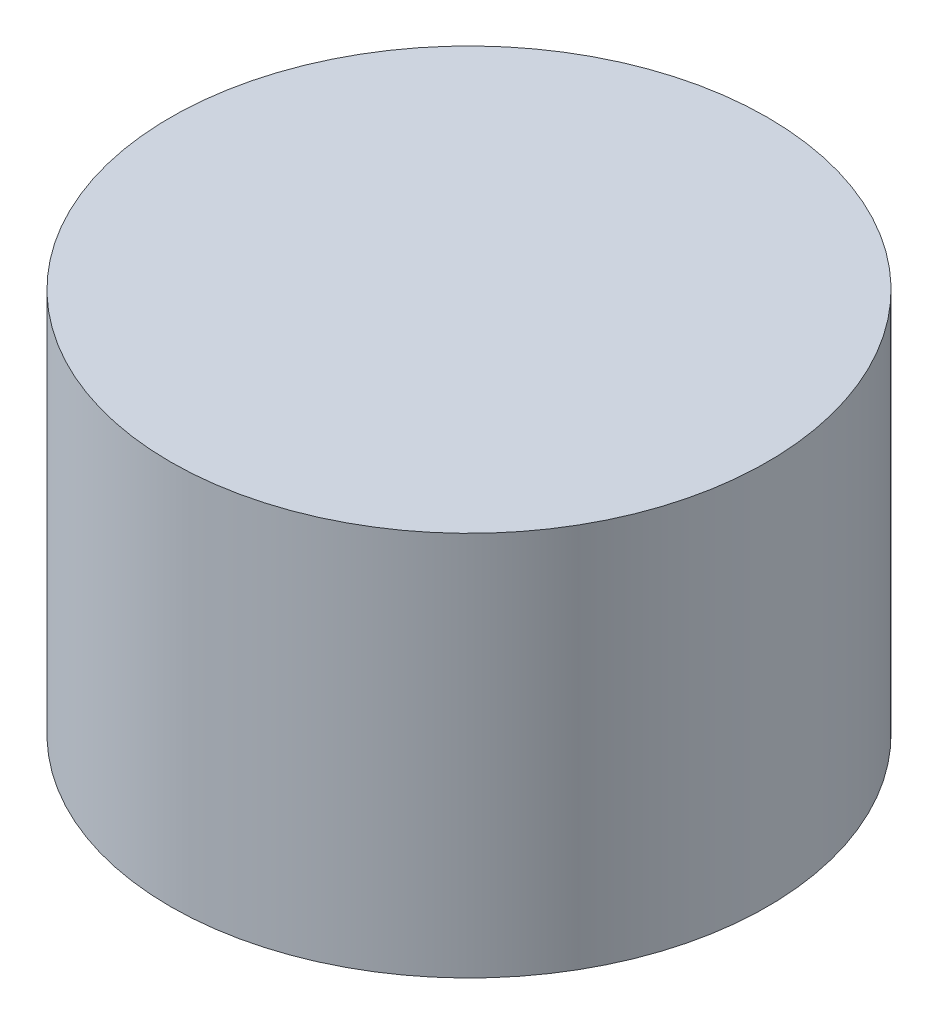
from build123d import *

# Parameters (mm, degrees)
SKETCH1_R           = 7.75
BOSS_EXTRUDE1_DEPTH = 10


with BuildPart() as part:
    # Sketch1 → Boss-Extrude1 (new body)
    with BuildSketch(Plane(origin=(0, 0, 0), x_dir=(1, 0, 0), z_dir=(0, 1, 0))):
        with Locations(Location((0, 0, 0), (0, 0, 270))):
            Circle(SKETCH1_R)
    extrude(amount=BOSS_EXTRUDE1_DEPTH)


solid = part.part
